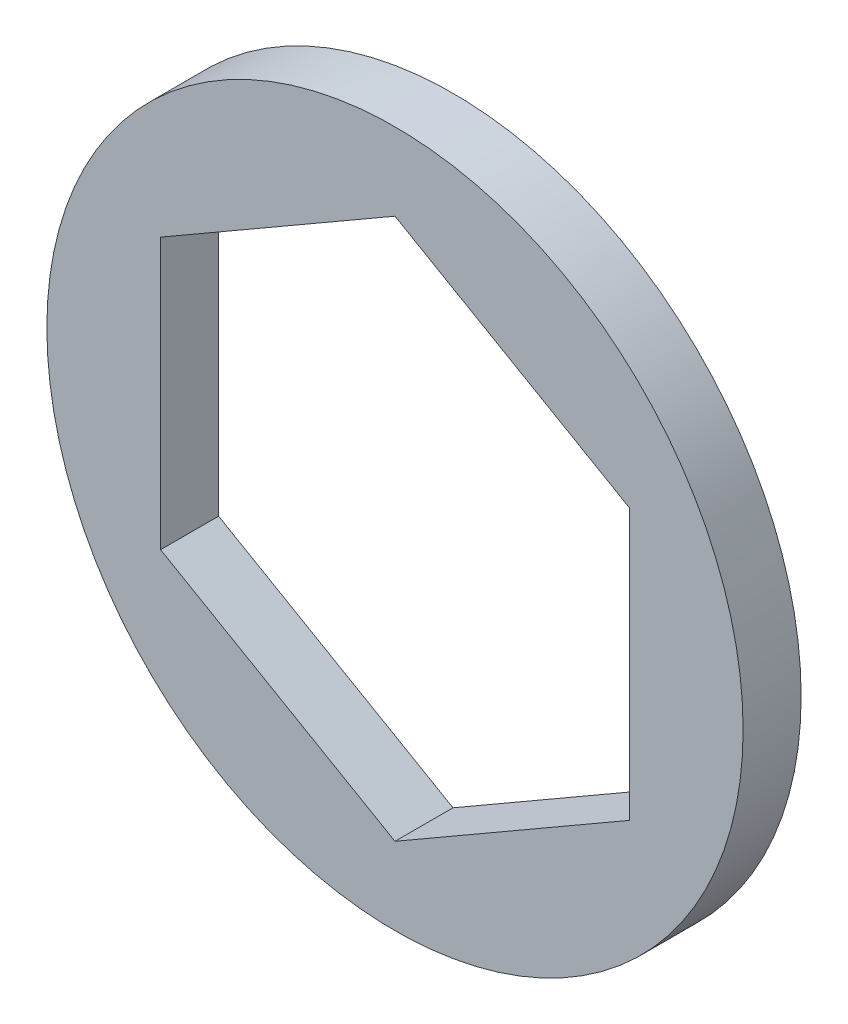
from build123d import *

# Parameters (mm, degrees)
SKETCH2_R           = 9.525
BOSS_EXTRUDE1_DEPTH = 1.5875


with BuildPart() as part:
    # Sketch2 → Boss-Extrude1 (new body)
    with BuildSketch(Plane.XY):
        Circle(SKETCH2_R)
        Polygon((6.4135, 3.702835951), (0, 7.405671903), (-6.4135, 3.702835951), (-6.4135, -3.702835951), (0, -7.405671903), (6.4135, -3.702835951), align=None, mode=Mode.SUBTRACT)
    extrude(amount=BOSS_EXTRUDE1_DEPTH)


solid = part.part
